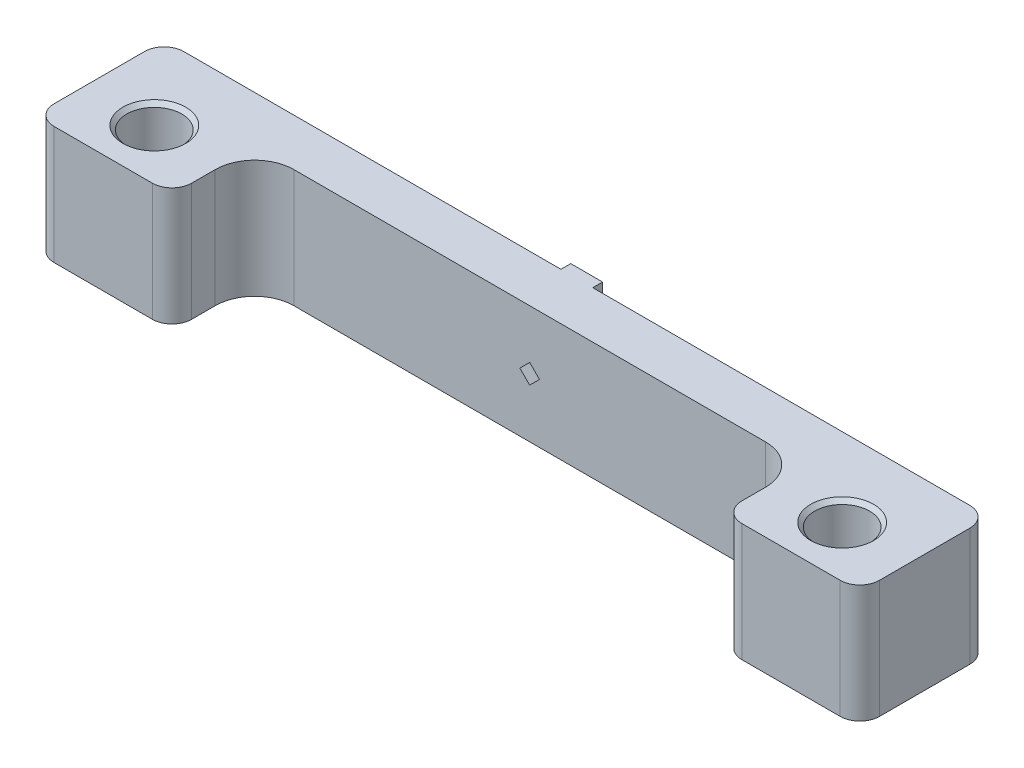
from build123d import *

# Parameters (mm, degrees)
AUFSATZ_LINEAR_AUSTRAGEN1_DEPTH = 30
SKIZZE2_R                       = 7
SCHNITT_LINEAR_AUSTRAGEN1_DEPTH = 20
SKIZZE5_W                       = 8.1
SKIZZE5_H                       = 30
AUFSATZ_LINEAR_AUSTRAGEN2_DEPTH = 3
FASE2_SIZE                      = 0.5
FASE1_SIZE                      = 1
VERRUNDUNG1_R                   = 5
VERRUNDUNG2_R                   = 10
SCHNITT_LINEAR_AUSTRAGEN2_REACH = 113.597
SKIZZE8_R                       = 2.5
SCHNITT_LINEAR_AUSTRAGEN3_DEPTH = 112.202517957


with BuildPart() as part:
    # Skizze1 → Aufsatz-Linear austragen1 (new body)
    with BuildSketch(Plane(origin=(0, 0, 0), x_dir=(1, 0, 0), z_dir=(0, 1, 0))):
        Polygon((-105, 0), (-105, -13), (-70, -13), (-70, 8), (70, 8), (70, -13), (105, -13), (105, 0), (105, 20), (-105, 20), align=None)
    extrude(amount=AUFSATZ_LINEAR_AUSTRAGEN1_DEPTH)

    # Skizze2 → Schnitt-Linear austragen1 (cut)
    with BuildSketch(Plane(origin=(0, 30, 0), x_dir=(1, 0, 0), z_dir=(0, 1, 0))):
        with Locations(Location((-87.5, 0, 0), (0, 0, 270))):
            Circle(SKIZZE2_R)
        with Locations(Location((87.5, 0, 0), (0, 0, 270))):
            Circle(SKIZZE2_R)
    extrude(amount=-SCHNITT_LINEAR_AUSTRAGEN1_DEPTH, mode=Mode.SUBTRACT)

    # Skizze5 → Aufsatz-Linear austragen2 (add)
    with BuildSketch(Plane(origin=(0, 0, -20), x_dir=(-1, 0, 0), z_dir=(0, 0, -1))):
        with Locations((0, 15)):
            Rectangle(SKIZZE5_W, SKIZZE5_H)
    extrude(amount=AUFSATZ_LINEAR_AUSTRAGEN2_DEPTH)

    # Fase2
    fase2_edges = [part.edges().sort_by_distance(p)[0] for p in [
        (-4.05, 15, -23),
        (0, 0, -23),
        (4.05, 15, -23),
        (0, 30, -23),
    ]]
    chamfer(fase2_edges, length=FASE2_SIZE)

    # Fase1
    fase1_edges = [part.edges().sort_by_distance(p)[0] for p in [
        (-87.5, 30, -7),
        (87.5, 30, -7),
    ]]
    chamfer(fase1_edges, length=FASE1_SIZE)

    # Verrundung1
    verrundung1_edges = [part.edges().sort_by_distance(p)[0] for p in [
        (-70, 15, 13),
        (-105, 15, 13),
        (105, 15, -20),
        (-105, 15, -20),
        (105, 15, 13),
        (70, 15, 13),
    ]]
    fillet(verrundung1_edges, radius=VERRUNDUNG1_R)

    # Verrundung2
    verrundung2_edges = [part.edges().sort_by_distance(p)[0] for p in [
        (70, 15, -8),
        (-70, 15, -8),
    ]]
    fillet(verrundung2_edges, radius=VERRUNDUNG2_R)

    # Skizze8 → Schnitt-Linear austragen2 (cut, up to next)
    with BuildSketch(Plane(origin=(0, 0, 0), x_dir=(1, 0, 0), z_dir=(0, 1, 0)), mode=Mode.PRIVATE) as schnitt_linear_austragen2_sk1:
        with Locations(Location((87.5, 0, 0), (0, 0, 90))):
            Circle(SKIZZE8_R)
    schnitt_linear_austragen2_tool1 = extrude(schnitt_linear_austragen2_sk1.sketch, amount=SCHNITT_LINEAR_AUSTRAGEN2_REACH, mode=Mode.PRIVATE) & part.part
    # Skizze8 → Schnitt-Linear austragen2 (cut, up to next)
    with BuildSketch(Plane(origin=(0, 0, 0), x_dir=(1, 0, 0), z_dir=(0, 1, 0)), mode=Mode.PRIVATE) as schnitt_linear_austragen2_sk2:
        with Locations(Location((-87.5, 0, 0), (0, 0, 90))):
            Circle(SKIZZE8_R)
    schnitt_linear_austragen2_tool2 = extrude(schnitt_linear_austragen2_sk2.sketch, amount=SCHNITT_LINEAR_AUSTRAGEN2_REACH, mode=Mode.PRIVATE) & part.part
    add(schnitt_linear_austragen2_tool1.solids().sort_by_distance((87.5, 0, 0))[0], mode=Mode.SUBTRACT)
    add(schnitt_linear_austragen2_tool2.solids().sort_by_distance((-87.5, 0, 0))[0], mode=Mode.SUBTRACT)

    # Skizze9 → Schnitt-Linear austragen3 (cut, through all)
    with BuildSketch(Plane.XY.offset(-8)):
        Polygon((0, 17.5), (-2.5, 15), (0, 12.5), (2.5, 15), align=None)
    extrude(amount=-SCHNITT_LINEAR_AUSTRAGEN3_DEPTH, mode=Mode.SUBTRACT)


solid = part.part
